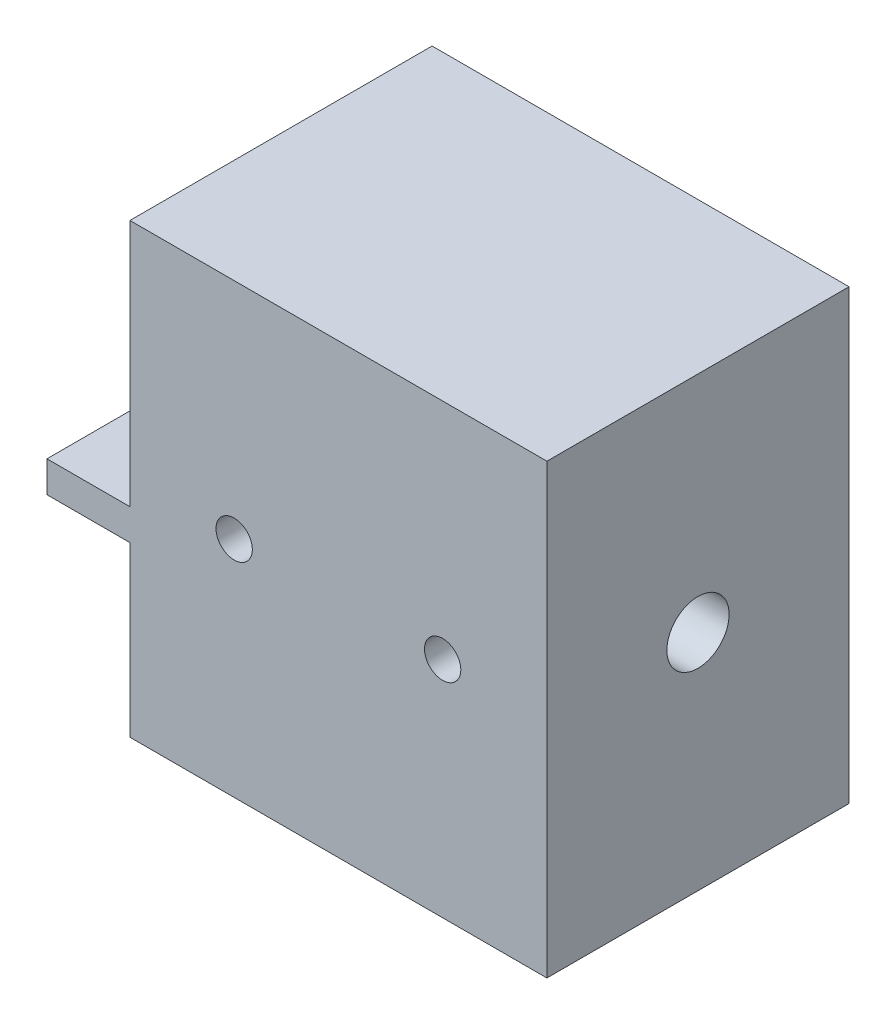
from build123d import *

# Parameters (mm, degrees)
SKETCH2_W               = 40.2
SKETCH2_H               = 43.15
BOSS_EXTRUDE1_DEPTH     = 29.13
SKETCH3_W               = 29.13
SKETCH3_H               = 3
BOSS_EXTRUDE2_DEPTH     = 8
CUT_EXTRUDE1_DEPTH      = 8
CUT_EXTRUDE1_DEPTH_BACK = 8
SKETCH4_R               = 1.75
SKETCH5_R               = 1.75
CUT_EXTRUDE2_DEPTH      = 40
SKETCH6_R               = 3
CUT_EXTRUDE3_DEPTH      = 18


with BuildPart() as part:
    # Sketch2 → Boss-Extrude1 (new body)
    with BuildSketch(Plane.XY):
        with Locations((-30.301325873, -3.793821583)):
            Rectangle(SKETCH2_W, SKETCH2_H)
    extrude(amount=BOSS_EXTRUDE1_DEPTH)

    # Sketch3 → Boss-Extrude2 (add)
    with BuildSketch(Plane.ZY.offset(50.401325873)):
        with Locations((14.565, -7.618821583)):
            Rectangle(SKETCH3_W, SKETCH3_H)
    extrude(amount=BOSS_EXTRUDE2_DEPTH)

    # Sketch4 → Cut-Extrude1 (cut, two sides: drawn at the far end of the back side and taken through both)
    with BuildSketch(Plane(origin=(0, -9.118821583, 0), x_dir=(1, 0, 0), z_dir=(0, 1, 0)).offset(-CUT_EXTRUDE1_DEPTH_BACK)):
        with Locations(Location((-53.601325886, -9.375, 0), (0, 0, 90))):
            Circle(SKETCH4_R)
        with Locations(Location((-53.601325886, -19.725, 0), (0, 0, 90))):
            Circle(SKETCH4_R)
    extrude(amount=CUT_EXTRUDE1_DEPTH + CUT_EXTRUDE1_DEPTH_BACK, mode=Mode.SUBTRACT)

    # Sketch5 → Cut-Extrude2 (cut)
    with BuildSketch(Plane(origin=(0, 0, 0), x_dir=(-1, 0, 0), z_dir=(0, 0, -1))):
        with Locations((40.351325873, -3.793821583)):
            Circle(SKETCH5_R)
        with Locations((20.251325873, -3.793821583)):
            Circle(SKETCH5_R)
    extrude(amount=-CUT_EXTRUDE2_DEPTH, mode=Mode.SUBTRACT)

    # Sketch6 → Cut-Extrude3 (cut)
    with BuildSketch(Plane(origin=(-10.201325873, 0, 0), x_dir=(0, 0, -1), z_dir=(1, 0, 0))):
        with Locations((-14.565, -3.793821583)):
            Circle(SKETCH6_R)
    extrude(amount=-CUT_EXTRUDE3_DEPTH, mode=Mode.SUBTRACT)


solid = part.part
